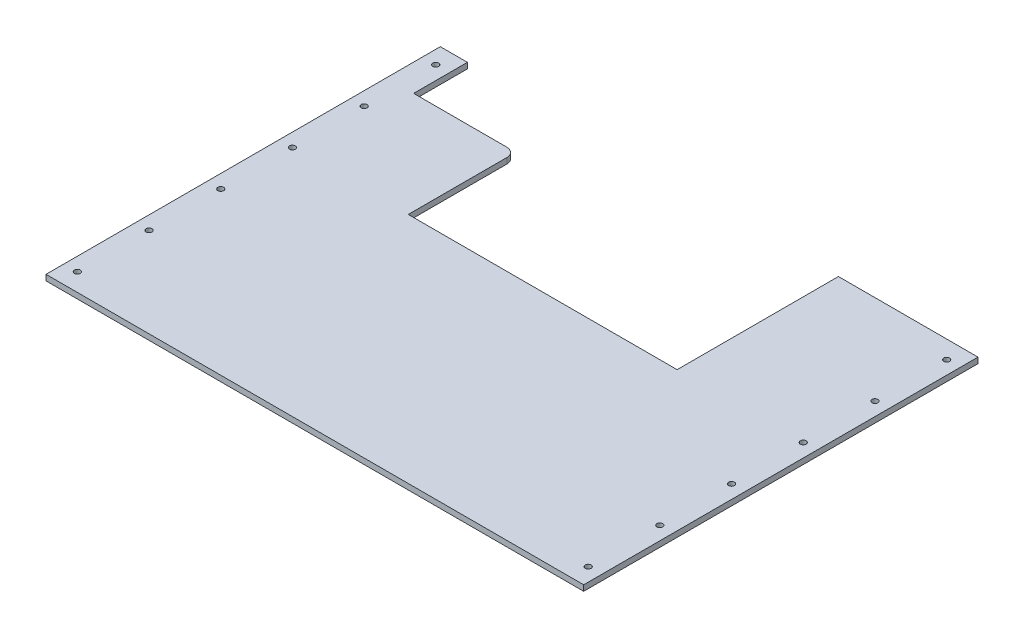
from build123d import *

# Parameters (mm, degrees)
BOSS_EXTRUDE1_DEPTH = 3.18
SKETCH2_R           = 1.65
CUT_EXTRUDE1_DEPTH  = 10
FILLET1_R           = 5


with BuildPart() as part:
    # Sketch1 → Boss-Extrude1 (new body)
    with BuildSketch(Plane(origin=(0, 0, 0), x_dir=(1, 0, 0), z_dir=(0, 1, 0))):
        Polygon((72.127496387, 91.855323554), (72.127496387, 1.855323554), (-77.872503613, 1.855323554), (-77.872503613, 61.855323554), (-134.872503613, 61.855323554), (-134.872503613, 91.855323554), (-150, 91.855323554), (-150, -128.144676446), (150, -128.144676446), (150, 91.855323554), align=None)
    extrude(amount=BOSS_EXTRUDE1_DEPTH)

    # Sketch2 → Cut-Extrude1 (cut)
    with BuildSketch(Plane(origin=(0, 3.18, 0), x_dir=(1, 0, 0), z_dir=(0, 1, 0))):
        with Locations(Location((-142.5, 81.855323554, 0), (0, 0, 270))):
            Circle(SKETCH2_R)
        with Locations(Location((-142.5, 41.855323554, 0), (0, 0, 270))):
            Circle(SKETCH2_R)
        with Locations(Location((-142.5, 1.855323554, 0), (0, 0, 270))):
            Circle(SKETCH2_R)
        with Locations(Location((-142.5, -38.144676446, 0), (0, 0, 270))):
            Circle(SKETCH2_R)
        with Locations(Location((-142.5, -78.144676446, 0), (0, 0, 270))):
            Circle(SKETCH2_R)
        with Locations(Location((-142.5, -118.144676446, 0), (0, 0, 270))):
            Circle(SKETCH2_R)
        with Locations(Location((142.5, 81.855323554, 0), (0, 0, 270))):
            Circle(SKETCH2_R)
        with Locations(Location((142.5, 41.855323554, 0), (0, 0, 270))):
            Circle(SKETCH2_R)
        with Locations(Location((142.5, 1.855323554, 0), (0, 0, 270))):
            Circle(SKETCH2_R)
        with Locations(Location((142.5, -38.144676446, 0), (0, 0, 270))):
            Circle(SKETCH2_R)
        with Locations(Location((142.5, -78.144676446, 0), (0, 0, 270))):
            Circle(SKETCH2_R)
        with Locations(Location((142.5, -118.144676446, 0), (0, 0, 270))):
            Circle(SKETCH2_R)
    extrude(amount=-CUT_EXTRUDE1_DEPTH, mode=Mode.SUBTRACT)

    # Fillet1
    fillet1_edges = [part.edges().sort_by_distance(p)[0] for p in [
        (-77.872503613, 1.59, -61.855323554),
    ]]
    fillet(fillet1_edges, radius=FILLET1_R)


solid = part.part
